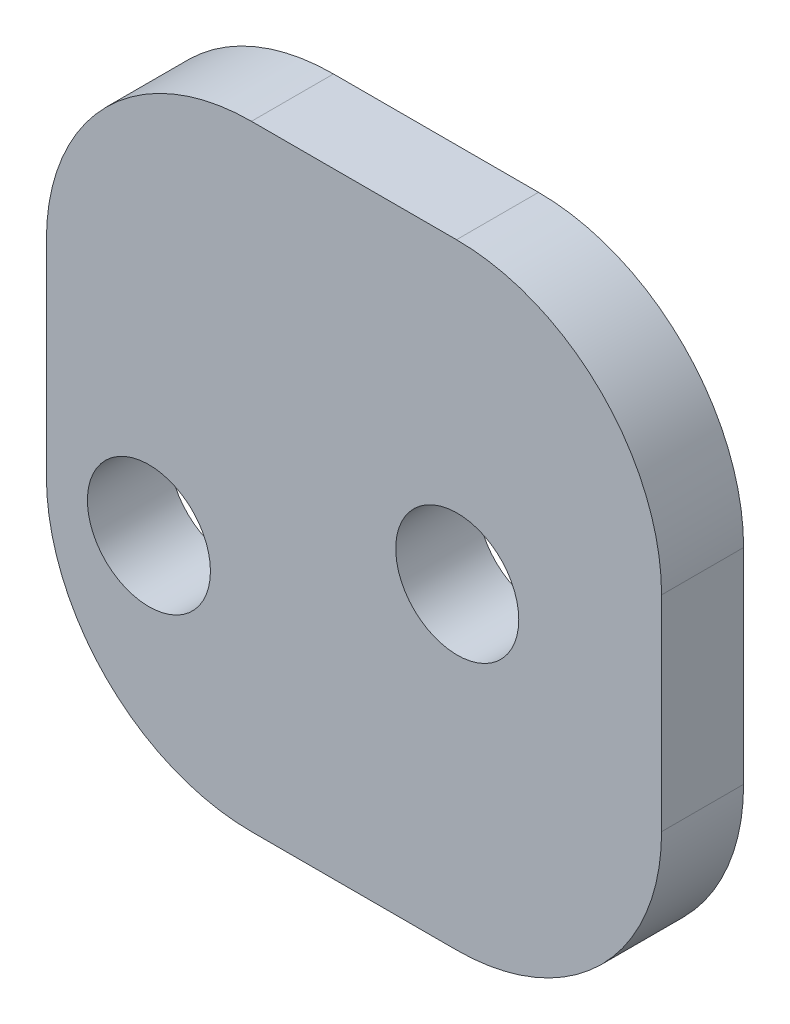
from build123d import *

# Parameters (mm, degrees)
SKETCH_1_W          = 40
SKETCH_1_H          = 15
EXTRUDE_1_DEPTH     = 2
SKETCH_3_R          = 1.5
CUT_EXTRUDE_1_DEPTH = 2
CUT_EXTRUDE_2_DEPTH = 10
FILLET_1_R          = 5


with BuildPart() as part:
    # 草图1 → 凸台-拉伸1 (new body)
    with BuildSketch(Plane.XY):
        Rectangle(SKETCH_1_W, SKETCH_1_H)
    extrude(amount=EXTRUDE_1_DEPTH)

    # 草图3 → 切除-拉伸1 (cut)
    with BuildSketch(Plane.XY.offset(2)):
        with Locations((-9.982459034, 0.236161147)):
            Circle(SKETCH_3_R)
        with Locations((-17.5, -2.5)):
            Circle(SKETCH_3_R)
    extrude(amount=-CUT_EXTRUDE_1_DEPTH, mode=Mode.SUBTRACT)

    # 草图6 → 切除-拉伸2 (cut)
    with BuildSketch(Plane.XY.offset(2)):
        Polygon((-5, 7.5), (-5, -7.5), (36.148851336, -18.495224014), (30.781609857, 18.543577541), align=None)
    extrude(amount=-CUT_EXTRUDE_2_DEPTH, mode=Mode.SUBTRACT)

    # 圆角1
    fillet_1_edges = [part.edges().sort_by_distance(p)[0] for p in [
        (-5, 7.5, 1),
        (-5, -7.5, 1),
        (-20, -7.5, 1),
        (-20, 7.5, 1),
    ]]
    fillet(fillet_1_edges, radius=FILLET_1_R)


solid = part.part
